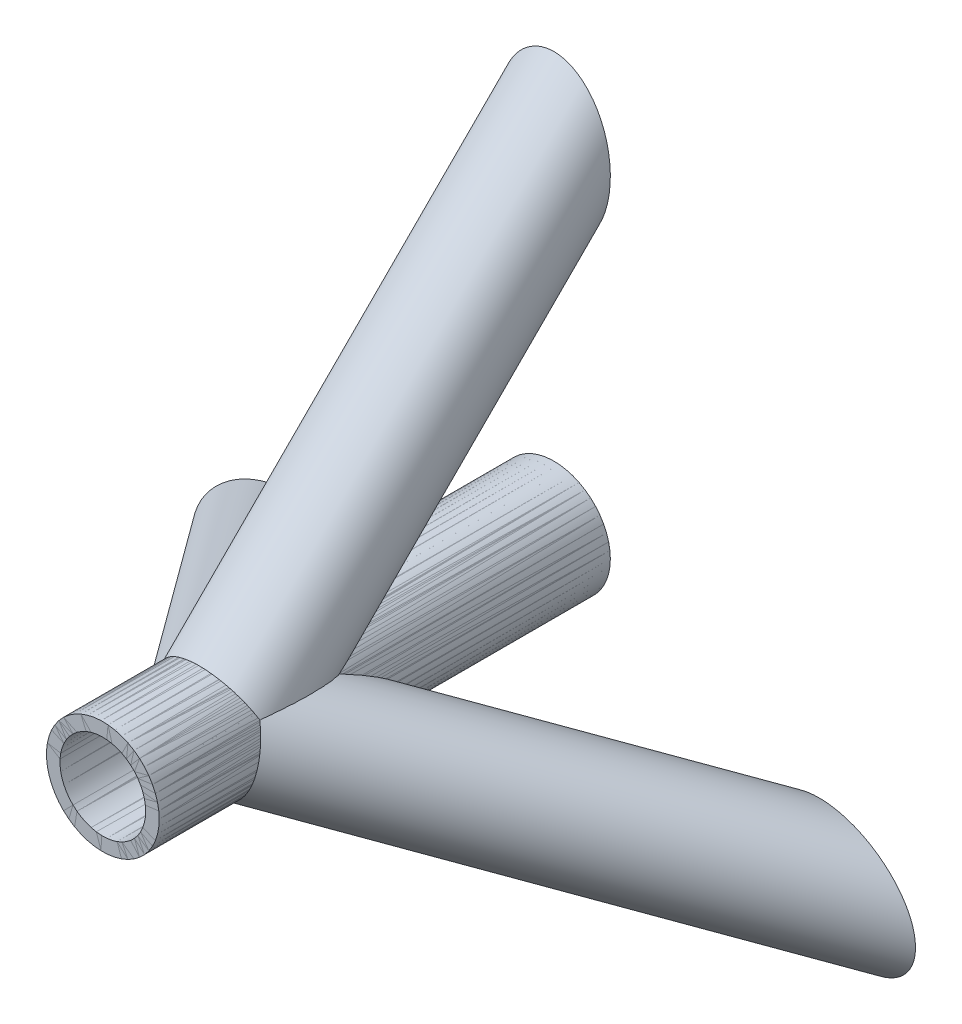
from build123d import *

# Parameters (mm, degrees)
ESQUISSE1_R                    = 12.5
ESQUISSE1_R_2                  = 9.5
BOSS_EXTRU_1_DEPTH             = 100
BOSS_EXTRU_3_REACH             = 103.55
BOSS_EXTRU_3_END_RADIUS        = 12.5
ESQUISSE5_R                    = 12.5
ESQUISSE5_R_2                  = 9.5
BOSS_EXTRU_3_DIRECTION_2_REACH = 103.55
R_P_TITION_CIRCULAIRE2_COUNT   = 3


with BuildPart() as part:
    # Esquisse1 → Boss.-Extru.1 (new body)
    with BuildSketch(Plane.XY):
        Circle(ESQUISSE1_R)
        Circle(ESQUISSE1_R_2, mode=Mode.SUBTRACT)
    extrude(amount=BOSS_EXTRU_1_DEPTH)

    # Boss.-Extru.3: up to this cylinder (the profile starts outside it)
    boss_extru_3_end = Plane(origin=(0, 0, 45.310536), z_dir=(0, 0, -1)) * Cylinder(BOSS_EXTRU_3_END_RADIUS, 233.1, mode=Mode.PRIVATE)
    # Esquisse5 → Boss.-Extru.3 (add, up to the surface)
    with BuildSketch(Plane(origin=(0, 0, 0), x_dir=(1, 0, 0), z_dir=(0, -0.7071067811865488, 0.7071067811865464)), mode=Mode.PRIVATE) as boss_extru_3_sk1:
        with Locations(Location((0, 51.932327574, 0), (0, 0, 270))):
            Circle(ESQUISSE5_R)
        with Locations(Location((0, 51.932327574, 0), (0, 0, 270))):
            Circle(ESQUISSE5_R_2, mode=Mode.SUBTRACT)
    boss_extru_3_tool1 = extrude(boss_extru_3_sk1.sketch, amount=BOSS_EXTRU_3_REACH, mode=Mode.PRIVATE) - boss_extru_3_end
    add(boss_extru_3_tool1.solids().sort_by_distance((0, 45.310536, 45.310536))[0])

    # Boss.-Extru.3 direction 2: up to this plane
    boss_extru_3_direction_2_end = Plane(origin=(0, 0, 0), z_dir=(0, 0, 1))
    # Esquisse5 → Boss.-Extru.3 direction 2 (add, up to the surface)
    with BuildSketch(Plane(origin=(0, 0, 0), x_dir=(1, 0, 0), z_dir=(0, -0.7071067811865488, 0.7071067811865464)), mode=Mode.PRIVATE) as boss_extru_3_direction_2_sk1:
        with Locations(Location((0, 51.932327574, 0), (0, 0, 270))):
            Circle(ESQUISSE5_R)
        with Locations(Location((0, 51.932327574, 0), (0, 0, 270))):
            Circle(ESQUISSE5_R_2, mode=Mode.SUBTRACT)
    boss_extru_3_direction_2_tool1 = split(extrude(boss_extru_3_direction_2_sk1.sketch, amount=-BOSS_EXTRU_3_DIRECTION_2_REACH, mode=Mode.PRIVATE), bisect_by=boss_extru_3_direction_2_end, keep=Keep.BOTH, mode=Mode.PRIVATE)
    add(boss_extru_3_direction_2_tool1.solids().sort_by_distance((0, 45.310536, 45.310536))[0])


with BuildPart() as r_p_tition_circulaire2_1:
    # Répétition circulaire2: pattern copy
    add(part.part.rotate(Axis((0, 0, 0), (0, 0, 1)), 1 * 360 / R_P_TITION_CIRCULAIRE2_COUNT))


with BuildPart() as r_p_tition_circulaire2_2:
    # Répétition circulaire2: pattern copy
    add(part.part.rotate(Axis((0, 0, 0), (0, 0, 1)), 2 * 360 / R_P_TITION_CIRCULAIRE2_COUNT))


solid = Compound([part.part, r_p_tition_circulaire2_1.part, r_p_tition_circulaire2_2.part])
